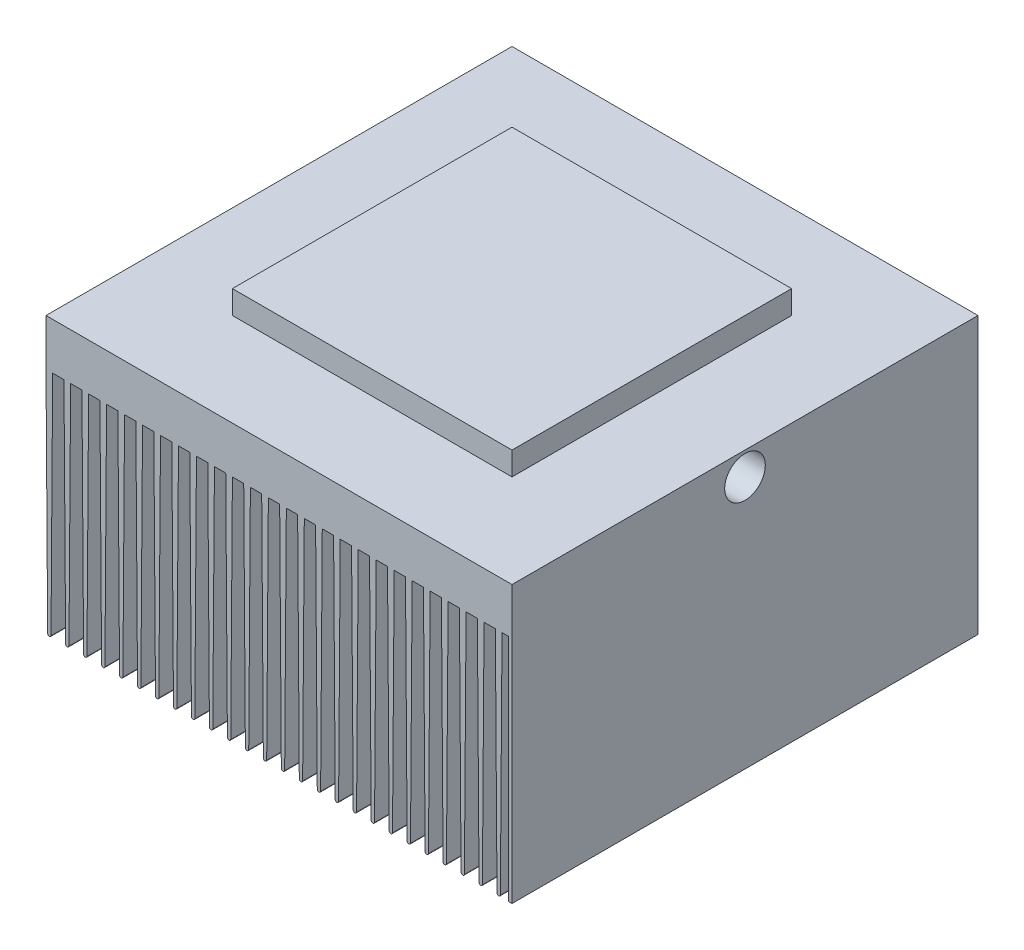
from build123d import *

# Parameters (mm, degrees)
SKETCH_1_W          = 70
SKETCH_1_H          = 70
EXTRUDE_1_DEPTH     = 41.5
SKETCH_2_W          = 42
SKETCH_2_H          = 42
EXTRUDE_2_DEPTH     = 3.5
CUT_EXTRUDE_1_DEPTH = 91.277350426
CUT_EXTRUDE_2_DEPTH = 91.277350426
FILLET_2_R          = 0.25
SKETCH_5_R          = 3.05
CUT_EXTRUDE_3_DEPTH = 52


with BuildPart() as part:
    # 草图1 → 凸台-拉伸1 (new body)
    with BuildSketch(Plane(origin=(0, 0, 0), x_dir=(1, 0, 0), z_dir=(0, 1, 0))):
        Rectangle(SKETCH_1_W, SKETCH_1_H)
    extrude(amount=EXTRUDE_1_DEPTH)

    # 草图2 → 凸台-拉伸2 (add)
    with BuildSketch(Plane(origin=(0, 41.5, 0), x_dir=(1, 0, 0), z_dir=(0, 1, 0))):
        Rectangle(SKETCH_2_W, SKETCH_2_H)
    extrude(amount=EXTRUDE_2_DEPTH)

    # 草图3 → 切除-拉伸1 (cut, through all)
    with BuildSketch(Plane.XY.offset(35)):
        with BuildLine():
            Line((-32.3, 34.5), (-34, 34.5))
            Line((-34, 34.5), (-34.248201533, 0.248188453))
            ThreePointArc((-34.248201533, 0.248188453), (-34.322059917, 0.072583982), (-34.498194969, 0))
            Line((-34.498194969, 0), (-31.801805031, 0))
            ThreePointArc((-31.801805031, 0), (-31.977940083, 0.072583982), (-32.051798467, 0.248188453))
            Line((-32.051798467, 0.248188453), (-32.3, 34.5))
        make_face()
        with BuildLine():
            Line((-29.6, 34.5), (-31.3, 34.5))
            Line((-31.3, 34.5), (-31.548201533, 0.248188453))
            ThreePointArc((-31.548201533, 0.248188453), (-31.622059917, 0.072583982), (-31.798194969, 0))
            Line((-31.798194969, 0), (-29.101805031, 0))
            ThreePointArc((-29.101805031, 0), (-29.277940083, 0.072583982), (-29.351798467, 0.248188453))
            Line((-29.351798467, 0.248188453), (-29.6, 34.5))
        make_face()
        with BuildLine():
            Line((-26.9, 34.5), (-28.6, 34.5))
            Line((-28.6, 34.5), (-28.848201533, 0.248188453))
            ThreePointArc((-28.848201533, 0.248188453), (-28.922059917, 0.072583982), (-29.098194969, 0))
            Line((-29.098194969, 0), (-26.401805031, 0))
            ThreePointArc((-26.401805031, 0), (-26.577940083, 0.072583982), (-26.651798467, 0.248188453))
            Line((-26.651798467, 0.248188453), (-26.9, 34.5))
        make_face()
        with BuildLine():
            Line((-24.2, 34.5), (-25.9, 34.5))
            Line((-25.9, 34.5), (-26.148201533, 0.248188453))
            ThreePointArc((-26.148201533, 0.248188453), (-26.222059917, 0.072583982), (-26.398194969, 0))
            Line((-26.398194969, 0), (-23.701805031, 0))
            ThreePointArc((-23.701805031, 0), (-23.877940083, 0.072583982), (-23.951798467, 0.248188453))
            Line((-23.951798467, 0.248188453), (-24.2, 34.5))
        make_face()
        with BuildLine():
            Line((-21.5, 34.5), (-23.2, 34.5))
            Line((-23.2, 34.5), (-23.448201533, 0.248188453))
            ThreePointArc((-23.448201533, 0.248188453), (-23.522059917, 0.072583982), (-23.698194969, 0))
            Line((-23.698194969, 0), (-21.001805031, 0))
            ThreePointArc((-21.001805031, 0), (-21.177940083, 0.072583982), (-21.251798467, 0.248188453))
            Line((-21.251798467, 0.248188453), (-21.5, 34.5))
        make_face()
        with BuildLine():
            Line((-18.8, 34.5), (-20.5, 34.5))
            Line((-20.5, 34.5), (-20.748201533, 0.248188453))
            ThreePointArc((-20.748201533, 0.248188453), (-20.822059917, 0.072583982), (-20.998194969, 0))
            Line((-20.998194969, 0), (-18.301805031, 0))
            ThreePointArc((-18.301805031, 0), (-18.477940083, 0.072583982), (-18.551798467, 0.248188453))
            Line((-18.551798467, 0.248188453), (-18.8, 34.5))
        make_face()
        with BuildLine():
            Line((-16.1, 34.5), (-17.8, 34.5))
            Line((-17.8, 34.5), (-18.048201533, 0.248188453))
            ThreePointArc((-18.048201533, 0.248188453), (-18.122059917, 0.072583982), (-18.298194969, 0))
            Line((-18.298194969, 0), (-15.601805031, 0))
            ThreePointArc((-15.601805031, 0), (-15.777940083, 0.072583982), (-15.851798467, 0.248188453))
            Line((-15.851798467, 0.248188453), (-16.1, 34.5))
        make_face()
        with BuildLine():
            Line((-13.4, 34.5), (-15.1, 34.5))
            Line((-15.1, 34.5), (-15.348201533, 0.248188453))
            ThreePointArc((-15.348201533, 0.248188453), (-15.422059917, 0.072583982), (-15.598194969, 0))
            Line((-15.598194969, 0), (-12.901805031, 0))
            ThreePointArc((-12.901805031, 0), (-13.077940083, 0.072583982), (-13.151798467, 0.248188453))
            Line((-13.151798467, 0.248188453), (-13.4, 34.5))
        make_face()
        with BuildLine():
            Line((-10.7, 34.5), (-12.4, 34.5))
            Line((-12.4, 34.5), (-12.648201533, 0.248188453))
            ThreePointArc((-12.648201533, 0.248188453), (-12.722059917, 0.072583982), (-12.898194969, 0))
            Line((-12.898194969, 0), (-10.201805031, 0))
            ThreePointArc((-10.201805031, 0), (-10.377940083, 0.072583982), (-10.451798467, 0.248188453))
            Line((-10.451798467, 0.248188453), (-10.7, 34.5))
        make_face()
        with BuildLine():
            Line((-8, 34.5), (-9.7, 34.5))
            Line((-9.7, 34.5), (-9.948201533, 0.248188453))
            ThreePointArc((-9.948201533, 0.248188453), (-10.022059917, 0.072583982), (-10.198194969, 0))
            Line((-10.198194969, 0), (-7.501805031, 0))
            ThreePointArc((-7.501805031, 0), (-7.677940083, 0.072583982), (-7.751798467, 0.248188453))
            Line((-7.751798467, 0.248188453), (-8, 34.5))
        make_face()
        with BuildLine():
            Line((-5.3, 34.5), (-7, 34.5))
            Line((-7, 34.5), (-7.248201533, 0.248188453))
            ThreePointArc((-7.248201533, 0.248188453), (-7.322059917, 0.072583982), (-7.498194969, 0))
            Line((-7.498194969, 0), (-4.801805031, 0))
            ThreePointArc((-4.801805031, 0), (-4.977940083, 0.072583982), (-5.051798467, 0.248188453))
            Line((-5.051798467, 0.248188453), (-5.3, 34.5))
        make_face()
        with BuildLine():
            Line((-2.6, 34.5), (-4.3, 34.5))
            Line((-4.3, 34.5), (-4.548201533, 0.248188453))
            ThreePointArc((-4.548201533, 0.248188453), (-4.622059917, 0.072583982), (-4.798194969, 0))
            Line((-4.798194969, 0), (-2.101805031, 0))
            ThreePointArc((-2.101805031, 0), (-2.277940083, 0.072583982), (-2.351798467, 0.248188453))
            Line((-2.351798467, 0.248188453), (-2.6, 34.5))
        make_face()
        with BuildLine():
            Line((0.1, 34.5), (-1.6, 34.5))
            Line((-1.6, 34.5), (-1.848201533, 0.248188453))
            ThreePointArc((-1.848201533, 0.248188453), (-1.922059917, 0.072583982), (-2.098194969, 0))
            Line((-2.098194969, 0), (0.598194969, 0))
            ThreePointArc((0.598194969, 0), (0.422059917, 0.072583982), (0.348201533, 0.248188453))
            Line((0.348201533, 0.248188453), (0.1, 34.5))
        make_face()
        with BuildLine():
            Line((2.8, 34.5), (1.1, 34.5))
            Line((1.1, 34.5), (0.851798467, 0.248188453))
            ThreePointArc((0.851798467, 0.248188453), (0.777940083, 0.072583982), (0.601805031, 0))
            Line((0.601805031, 0), (3.298194969, 0))
            ThreePointArc((3.298194969, 0), (3.122059917, 0.072583982), (3.048201533, 0.248188453))
            Line((3.048201533, 0.248188453), (2.8, 34.5))
        make_face()
        with BuildLine():
            Line((5.5, 34.5), (3.8, 34.5))
            Line((3.8, 34.5), (3.551798467, 0.248188453))
            ThreePointArc((3.551798467, 0.248188453), (3.477940083, 0.072583982), (3.301805031, 0))
            Line((3.301805031, 0), (5.998194969, 0))
            ThreePointArc((5.998194969, 0), (5.822059917, 0.072583982), (5.748201533, 0.248188453))
            Line((5.748201533, 0.248188453), (5.5, 34.5))
        make_face()
        with BuildLine():
            Line((8.2, 34.5), (6.5, 34.5))
            Line((6.5, 34.5), (6.251798467, 0.248188453))
            ThreePointArc((6.251798467, 0.248188453), (6.177940083, 0.072583982), (6.001805031, 0))
            Line((6.001805031, 0), (8.698194969, 0))
            ThreePointArc((8.698194969, 0), (8.522059917, 0.072583982), (8.448201533, 0.248188453))
            Line((8.448201533, 0.248188453), (8.2, 34.5))
        make_face()
        with BuildLine():
            Line((10.9, 34.5), (9.2, 34.5))
            Line((9.2, 34.5), (8.951798467, 0.248188453))
            ThreePointArc((8.951798467, 0.248188453), (8.877940083, 0.072583982), (8.701805031, 0))
            Line((8.701805031, 0), (11.398194969, 0))
            ThreePointArc((11.398194969, 0), (11.222059917, 0.072583982), (11.148201533, 0.248188453))
            Line((11.148201533, 0.248188453), (10.9, 34.5))
        make_face()
        with BuildLine():
            Line((13.6, 34.5), (11.9, 34.5))
            Line((11.9, 34.5), (11.651798467, 0.248188453))
            ThreePointArc((11.651798467, 0.248188453), (11.577940083, 0.072583982), (11.401805031, 0))
            Line((11.401805031, 0), (14.098194969, 0))
            ThreePointArc((14.098194969, 0), (13.922059917, 0.072583982), (13.848201533, 0.248188453))
            Line((13.848201533, 0.248188453), (13.6, 34.5))
        make_face()
        with BuildLine():
            Line((16.3, 34.5), (14.6, 34.5))
            Line((14.6, 34.5), (14.351798467, 0.248188453))
            ThreePointArc((14.351798467, 0.248188453), (14.277940083, 0.072583982), (14.101805031, 0))
            Line((14.101805031, 0), (16.798194969, 0))
            ThreePointArc((16.798194969, 0), (16.622059917, 0.072583982), (16.548201533, 0.248188453))
            Line((16.548201533, 0.248188453), (16.3, 34.5))
        make_face()
        with BuildLine():
            Line((21.7, 34.5), (20, 34.5))
            Line((20, 34.5), (19.751798467, 0.248188453))
            ThreePointArc((19.751798467, 0.248188453), (19.677940083, 0.072583982), (19.501805031, 0))
            Line((19.501805031, 0), (22.198194969, 0))
            ThreePointArc((22.198194969, 0), (22.022059917, 0.072583982), (21.948201533, 0.248188453))
            Line((21.948201533, 0.248188453), (21.7, 34.5))
        make_face()
        with BuildLine():
            Line((24.4, 34.5), (22.7, 34.5))
            Line((22.7, 34.5), (22.451798467, 0.248188453))
            ThreePointArc((22.451798467, 0.248188453), (22.377940083, 0.072583982), (22.201805031, 0))
            Line((22.201805031, 0), (24.898194969, 0))
            ThreePointArc((24.898194969, 0), (24.722059917, 0.072583982), (24.648201533, 0.248188453))
            Line((24.648201533, 0.248188453), (24.4, 34.5))
        make_face()
        with BuildLine():
            Line((19, 34.5), (17.3, 34.5))
            Line((17.3, 34.5), (17.051798467, 0.248188453))
            ThreePointArc((17.051798467, 0.248188453), (16.977940083, 0.072583982), (16.801805031, 0))
            Line((16.801805031, 0), (19.498194969, 0))
            ThreePointArc((19.498194969, 0), (19.322059917, 0.072583982), (19.248201533, 0.248188453))
            Line((19.248201533, 0.248188453), (19, 34.5))
        make_face()
        with BuildLine():
            Line((27.1, 34.5), (25.4, 34.5))
            Line((25.4, 34.5), (25.151798467, 0.248188453))
            ThreePointArc((25.151798467, 0.248188453), (25.077940083, 0.072583982), (24.901805031, 0))
            Line((24.901805031, 0), (27.598194969, 0))
            ThreePointArc((27.598194969, 0), (27.422059917, 0.072583982), (27.348201533, 0.248188453))
            Line((27.348201533, 0.248188453), (27.1, 34.5))
        make_face()
        with BuildLine():
            Line((29.8, 34.5), (28.1, 34.5))
            Line((28.1, 34.5), (27.851798467, 0.248188453))
            ThreePointArc((27.851798467, 0.248188453), (27.777940083, 0.072583982), (27.601805031, 0))
            Line((27.601805031, 0), (30.298194969, 0))
            ThreePointArc((30.298194969, 0), (30.122059917, 0.072583982), (30.048201533, 0.248188453))
            Line((30.048201533, 0.248188453), (29.8, 34.5))
        make_face()
        with BuildLine():
            Line((32.5, 34.5), (30.8, 34.5))
            Line((30.8, 34.5), (30.551798467, 0.248188453))
            ThreePointArc((30.551798467, 0.248188453), (30.477940083, 0.072583982), (30.301805031, 0))
            Line((30.301805031, 0), (32.998194969, 0))
            ThreePointArc((32.998194969, 0), (32.822059917, 0.072583982), (32.748201533, 0.248188453))
            Line((32.748201533, 0.248188453), (32.5, 34.5))
        make_face()
        with BuildLine():
            Line((34.5, 34.5), (33.5, 34.5))
            Line((33.5, 34.5), (33.251798467, 0.248188453))
            ThreePointArc((33.251798467, 0.248188453), (33.177940083, 0.072583982), (33.001805031, 0))
            Line((33.001805031, 0), (34.5, 0))
            Line((34.5, 0), (34.5, 34.5))
        make_face()
    extrude(amount=-CUT_EXTRUDE_1_DEPTH, mode=Mode.SUBTRACT)

    # 草图4 → 切除-拉伸2 (cut, through all)
    with BuildSketch(Plane.XY.offset(35)):
        Polygon((-35, 0), (-35, 34.5), (-34.75, 0), align=None)
    extrude(amount=-CUT_EXTRUDE_2_DEPTH, mode=Mode.SUBTRACT)

    # 圆角2
    fillet_2_edges = [part.edges().sort_by_distance(p)[0] for p in [
        (-34.75, 0, 0),
    ]]
    fillet(fillet_2_edges, radius=FILLET_2_R)

    # 草图5 → 切除-拉伸3 (cut)
    with BuildSketch(Plane(origin=(35, 0, 0), x_dir=(0, 0, -1), z_dir=(1, 0, 0))):
        with Locations((0, 38)):
            Circle(SKETCH_5_R)
    extrude(amount=-CUT_EXTRUDE_3_DEPTH, mode=Mode.SUBTRACT)


solid = part.part
